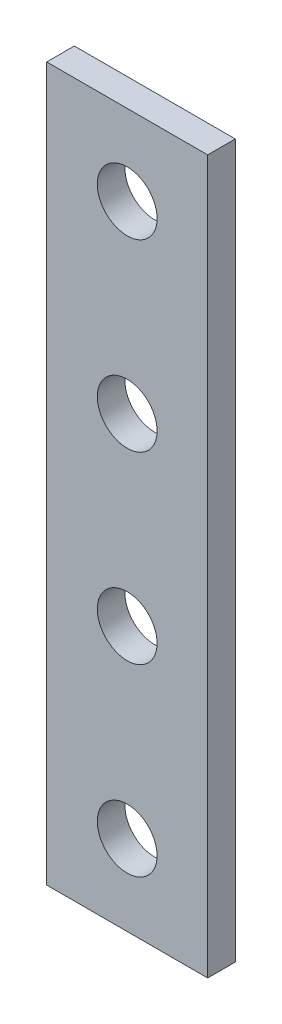
from build123d import *

# Parameters (mm, degrees)
SKETCH_1_W             = 70
SKETCH_1_H             = 310
EXTRUDE_1_DEPTH        = 12
SKETCH_2_R             = 13
CUT_EXTRUDE_1_DEPTH    = 160.354949719
PATTERN_LINEAR_1_COUNT = 4
PATTERN_LINEAR_1_PITCH = 80


with BuildPart() as part:
    # 草图1 → 凸台-拉伸1 (new body)
    with BuildSketch(Plane.XY):
        Rectangle(SKETCH_1_W, SKETCH_1_H)
    extrude(amount=EXTRUDE_1_DEPTH)

    # 草图2 → 切除-拉伸1 (cut, through all)
    with BuildSketch(Plane.XY.offset(12)):
        with Locations((0, 120)):
            Circle(SKETCH_2_R)
    cut_extrude_1 = extrude(amount=-CUT_EXTRUDE_1_DEPTH, mode=Mode.SUBTRACT)

    # 阵列(线性)1: 切除-拉伸1 ×4
    with Locations(*[(0, -i * PATTERN_LINEAR_1_PITCH, 0) for i in range(1, PATTERN_LINEAR_1_COUNT)]):
        add(cut_extrude_1, mode=Mode.SUBTRACT)


solid = part.part
